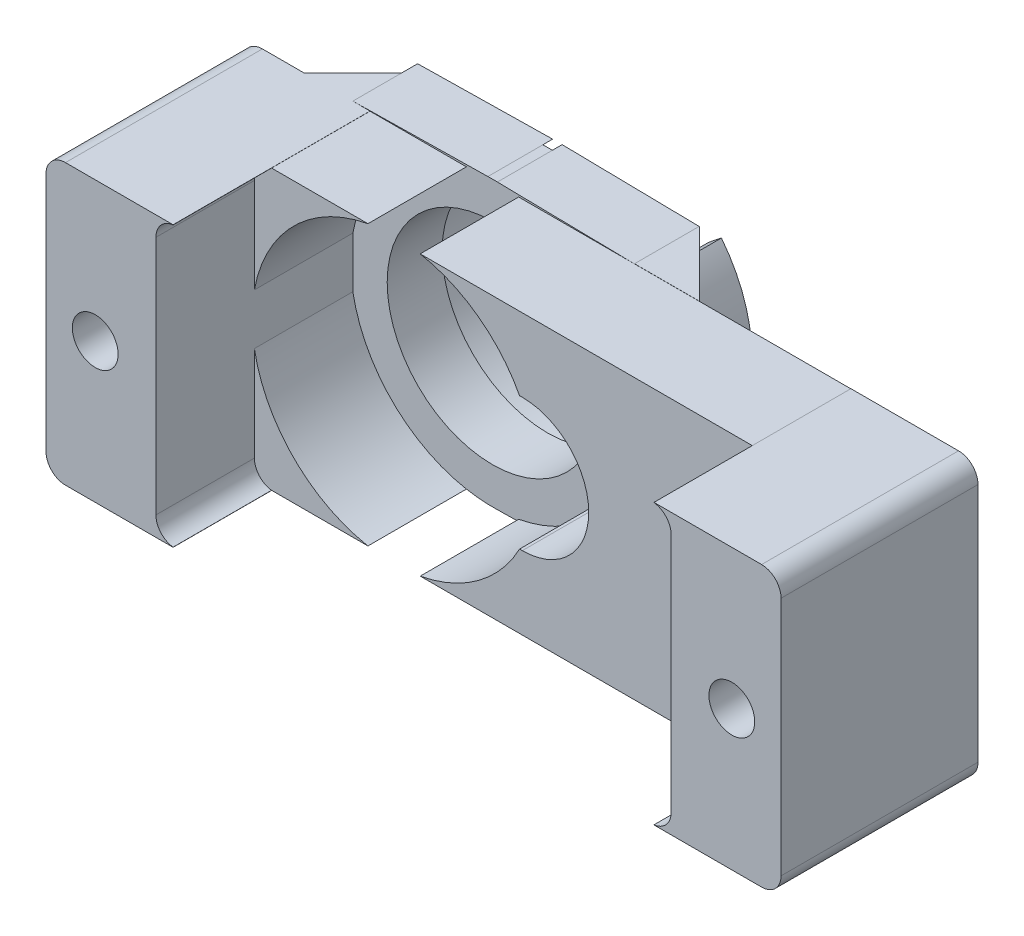
from build123d import *
from build123d.topology import SkipClean

# Parameters (mm, degrees)
SKETCH1_W           = 32.1
SKETCH1_H           = 12.2
BOSS_EXTRUDE1_DEPTH = 4.3
FILLET1_R           = 0.85
CUT_EXTRUDE1_DEPTH  = 10
SKETCH3_R           = 1
CUT_EXTRUDE2_DEPTH  = 5
BOSS_EXTRUDE2_DEPTH = 4.3
SKETCH6_R           = 4.6
BOSS_EXTRUDE3_DEPTH = 2.4
CUT_EXTRUDE4_DEPTH  = 2.4
SKETCH7_R           = 5.5
BOSS_EXTRUDE4_DEPTH = 2.729404
CUT_EXTRUDE3_DEPTH  = 2.729404426
BOSS_EXTRUDE5_DEPTH = 12.194097
BOSS_EXTRUDE6_DEPTH = 2.82843


with BuildPart() as part:
    # Sketch1 → Boss-Extrude1 (new body)
    with BuildSketch(Plane.XY):
        Rectangle(SKETCH1_W, SKETCH1_H)
    extrude(amount=BOSS_EXTRUDE1_DEPTH)

    # Fillet1
    fillet1_edges = [part.edges().sort_by_distance(p)[0] for p in [
        (16.05, -6.1, 2.15),
        (-16.05, -6.1, 2.15),
        (-16.05, 6.1, 2.15),
        (16.05, 6.1, 2.15),
    ]]
    fillet(fillet1_edges, radius=FILLET1_R)

    # Sketch2 → Cut-Extrude1 (cut)
    with BuildSketch(Plane(origin=(0, 0, 0), x_dir=(-1, 0, 0), z_dir=(0, 0, -1))):
        with BuildLine():
            ThreePointArc((-10.4, 6), (-10.930330086, 5.780330086), (-11.15, 5.25))
            Line((-11.15, 5.25), (-11.15, -5.25))
            ThreePointArc((-11.15, -5.25), (-10.930330086, -5.780330086), (-10.4, -6))
            Line((-10.4, -6), (-10.4, -6.1))
            Line((-10.4, -6.1), (10.4, -6.1))
            Line((10.4, -6.1), (10.4, -6))
            ThreePointArc((10.4, -6), (10.930330086, -5.780330086), (11.15, -5.25))
            Line((11.15, -5.25), (11.15, 5.25))
            ThreePointArc((11.15, 5.25), (10.930330086, 5.780330086), (10.4, 6))
            Line((10.4, 6), (10.4, 6.1))
            Line((10.4, 6.1), (-10.4, 6.1))
            Line((-10.4, 6.1), (-10.4, 6))
        make_face()
        with BuildLine():
            Line((-11.15, -5.25), (-11.15, 5.25))
            ThreePointArc((-11.15, 5.25), (-10.930330086, 5.780330086), (-10.4, 6))
            Line((-10.4, 6), (-10.4, 6.1))
            Line((-10.4, 6.1), (-10.5, 6.1))
            Line((-10.5, 6.1), (-10.5, 6.094097151))
            ThreePointArc((-10.5, 6.094097151), (-11.035413251, 5.81457949), (-11.25, 5.25))
            Line((-11.25, 5.25), (-11.25, -5.25))
            ThreePointArc((-11.25, -5.25), (-11.035413251, -5.81457949), (-10.5, -6.094097151))
            Line((-10.5, -6.094097151), (-10.5, -6.1))
            Line((-10.5, -6.1), (-10.4, -6.1))
            Line((-10.4, -6.1), (-10.4, -6))
            ThreePointArc((-10.4, -6), (-10.930330086, -5.780330086), (-11.15, -5.25))
        make_face()
        with BuildLine():
            Line((10.5, 6.1), (10.4, 6.1))
            Line((10.4, 6.1), (10.4, 6))
            ThreePointArc((10.4, 6), (10.930330086, 5.780330086), (11.15, 5.25))
            Line((11.15, 5.25), (11.15, -5.25))
            ThreePointArc((11.15, -5.25), (10.930330086, -5.780330086), (10.4, -6))
            Line((10.4, -6), (10.4, -6.1))
            Line((10.4, -6.1), (10.5, -6.1))
            Line((10.5, -6.1), (10.5, -6.094097151))
            ThreePointArc((10.5, -6.094097151), (11.035413251, -5.81457949), (11.25, -5.25))
            Line((11.25, -5.25), (11.25, 5.25))
            ThreePointArc((11.25, 5.25), (11.035413251, 5.81457949), (10.5, 6.094097151))
            Line((10.5, 6.094097151), (10.5, 6.1))
        make_face()
    extrude(amount=-CUT_EXTRUDE1_DEPTH, mode=Mode.SUBTRACT)


with BuildPart() as cut_extrude1_piece_1:
    # of the separate pieces the step leaves, piece 1, a body of its own (cut_extrude1_pieces)
    add(part.part.solids().sort_by_distance((-15.2, -6.1, 0))[0])


with BuildPart() as cut_extrude1_piece_2:
    # of the separate pieces the step leaves, piece 2, a body of its own (cut_extrude1_pieces)
    add(part.part.solids().sort_by_distance((10.5, -6.1, 0))[0])


with BuildPart() as cut_extrude2_tool:
    # Sketch3 → Cut-Extrude2 (new body)
    with BuildSketch(Plane.XY.offset(4.3)):
        with Locations((-13.9, 0)):
            Circle(SKETCH3_R)
        with Locations((13.9, 0)):
            Circle(SKETCH3_R)
    extrude(amount=-CUT_EXTRUDE2_DEPTH)


with BuildPart() as cut_extrude1_piece_1_1:
    add(cut_extrude1_piece_1.part)

    # Cut-Extrude2: cut by cut_extrude2_tool
    add(cut_extrude2_tool.part, mode=Mode.SUBTRACT)



with BuildPart() as cut_extrude1_piece_2_1:
    add(cut_extrude1_piece_2.part)

    # Cut-Extrude2: cut by cut_extrude2_tool
    add(cut_extrude2_tool.part, mode=Mode.SUBTRACT)


with BuildPart() as cut_extrude1_piece_1_2:
    add(cut_extrude1_piece_1_1.part)

    add(cut_extrude1_piece_2_1.part)  # Boss-Extrude2 merges Cut-Extrude1 piece 2
    # Sketch5 → Boss-Extrude2 (add)
    with BuildSketch(Plane(origin=(0, 0, 0), x_dir=(-1, 0, 0), z_dir=(0, 0, -1))):
        with BuildLine():
            Line((10.5, 6.1), (10.5, 6.094097151))
            Line((10.5, 6.094097151), (6.291043346, 6.094097151))
            ThreePointArc((6.291043346, 6.094097151), (9.545547959, 4.372545957), (11.25, 1.109053651))
            Line((11.25, 1.109053651), (11.25, -1.109053651))
            ThreePointArc((11.25, -1.109053651), (9.545547959, -4.372545957), (6.291043346, -6.094097151))
            Line((6.291043346, -6.094097151), (10.5, -6.094097151))
            Line((10.5, -6.094097151), (10.5, -6.1))
            Line((10.5, -6.1), (15.2, -6.1))
            ThreePointArc((15.2, -6.1), (15.801040764, -5.851040764), (16.05, -5.25))
            Line((16.05, -5.25), (16.05, 5.25))
            ThreePointArc((16.05, 5.25), (15.801040764, 5.851040764), (15.2, 6.1))
            Line((15.2, 6.1), (10.5, 6.1))
        make_face()
        with BuildLine():
            ThreePointArc((-0.329963504, 2.9), (1.474405208, 4.992995386), (4.008956654, 6.094097151))
            Line((4.008956654, 6.094097151), (-10.5, 6.094097151))
            Line((-10.5, 6.094097151), (-10.5, 6.1))
            Line((-10.5, 6.1), (-15.2, 6.1))
            ThreePointArc((-15.2, 6.1), (-15.801040764, 5.851040764), (-16.05, 5.25))
            Line((-16.05, 5.25), (-16.05, -5.25))
            ThreePointArc((-16.05, -5.25), (-15.801040764, -5.851040764), (-15.2, -6.1))
            Line((-15.2, -6.1), (-10.5, -6.1))
            Line((-10.5, -6.1), (-10.5, -6.094097151))
            Line((-10.5, -6.094097151), (4.008956654, -6.094097151))
            ThreePointArc((4.008956654, -6.094097151), (1.474405208, -4.992995386), (-0.329963504, -2.9))
            Line((-0.329963504, -2.9), (-0.45, -2.9))
            ThreePointArc((-0.45, -2.9), (-3.35, 0), (-0.45, 2.9))
            Line((-0.45, 2.9), (-0.329963504, 2.9))
        make_face()
    extrude(amount=BOSS_EXTRUDE2_DEPTH)

    # Sketch12 → Boss-Extrude5 (add)
    with BuildSketch(Plane.XZ.offset(6.094097151)):
        Polygon((1.05, -7.128427125), (3.878427125, -4.3), (1.05, -4.3), align=None)
        Polygon((-11.25, -6.421320344), (-13.371320344, -4.3), (-11.25, -4.3), align=None)
    extrude(amount=-BOSS_EXTRUDE5_DEPTH)



with BuildPart() as body_2:
    # Sketch6 → Boss-Extrude3 (new body)
    with BuildSketch(Plane(origin=(0, 0, -4.3), x_dir=(-1, 0, 0), z_dir=(0, 0, -1))):
        with BuildLine():
            Line((-0.329963504, -2.9), (-0.45, -2.9))
            ThreePointArc((-0.45, -2.9), (-3.35, 0), (-0.45, 2.9))
            Line((-0.45, 2.9), (-0.329963504, 2.9))
            ThreePointArc((-0.329963504, 2.9), (2.45609555, 5.584163215), (6.291043346, 6.094097151))
            ThreePointArc((6.291043346, 6.094097151), (9.545547959, 4.372545957), (11.25, 1.109053651))
            Line((11.25, 1.109053651), (11.25, -1.109053651))
            ThreePointArc((11.25, -1.109053651), (9.545547959, -4.372545957), (6.291043346, -6.094097151))
            ThreePointArc((6.291043346, -6.094097151), (2.45609555, -5.584163215), (-0.329963504, -2.9))
        make_face()
        with Locations((5.15, 0)):
            Circle(SKETCH6_R, mode=Mode.SUBTRACT)
    extrude(amount=BOSS_EXTRUDE3_DEPTH)

    # Sketch11 → Cut-Extrude4 (cut)
    with BuildSketch(Plane(origin=(0, 0, -6.7), x_dir=(-1, 0, 0), z_dir=(0, 0, -1))):
        with BuildLine():
            ThreePointArc((-0.329963504, -2.9), (-1.05, 0), (-0.329963504, 2.9))
            Line((-0.329963504, 2.9), (-0.45, 2.9))
            ThreePointArc((-0.45, 2.9), (-3.35, 0), (-0.45, -2.9))
            Line((-0.45, -2.9), (-0.329963504, -2.9))
        make_face()
        with BuildLine():
            ThreePointArc((-0.329963504, 2.9), (-0.172147578, 3.180368714), (0, 3.452173229))
            Line((0, 3.452173229), (-4.085462696, 3.186724013))
            Line((-4.085462696, 3.186724013), (-4.085462696, -3.40285267))
            Line((-4.085462696, -3.40285267), (0, -3.452173229))
            ThreePointArc((0, -3.452173229), (-0.172147578, -3.180368714), (-0.329963504, -2.9))
            Line((-0.329963504, -2.9), (-0.45, -2.9))
            ThreePointArc((-0.45, -2.9), (-3.35, 0), (-0.45, 2.9))
            Line((-0.45, 2.9), (-0.329963504, 2.9))
        make_face()
    extrude(amount=-CUT_EXTRUDE4_DEPTH, mode=Mode.SUBTRACT)

    # Sketch7 → Boss-Extrude4 (add)
    with SkipClean():  # the faces are left unmerged after this step: merging them gives an invalid solid
        with BuildSketch(Plane(origin=(0, 0, -6.7), x_dir=(-1, 0, 0), z_dir=(0, 0, -1))):
            with BuildLine():
                Line((11.25, -1.109053651), (11.25, 1.109053651))
                ThreePointArc((11.25, 1.109053651), (6.097619924, 6.127154028), (-0.329963504, 2.9))
                ThreePointArc((-0.329963504, 2.9), (-1.05, 0), (-0.329963504, -2.9))
                ThreePointArc((-0.329963504, -2.9), (6.097619924, -6.127154028), (11.25, -1.109053651))
            make_face()
            with Locations((5.15, 0)):
                Circle(SKETCH7_R, mode=Mode.SUBTRACT)
        extrude(amount=BOSS_EXTRUDE4_DEPTH)

    # Sketch8 → Cut-Extrude3 (cut)
    with SkipClean():  # the faces are left unmerged after this step: merging them gives an invalid solid
        with BuildSketch(Plane(origin=(0, 0, -9.429404426), x_dir=(-1, 0, 0), z_dir=(0, 0, -1))):
            Polygon((9.467113453, 3.407716454), (10.016564256, 3.841425821), (10.016564256, 6.311111289), (0.283435744, 6.311111289), (0.283435744, 3.841425821), (0.832886547, 3.407716454), align=None)
        extrude(amount=-CUT_EXTRUDE3_DEPTH, mode=Mode.SUBTRACT)


with BuildPart() as cut_extrude1_piece_1_3:
    with SkipClean():  # the faces are left unmerged after this step: merging them gives an invalid solid
        add(cut_extrude1_piece_1_2.part)

        add(body_2.part)  # Boss-Extrude6 merges body 2
        # Sketch13 → Boss-Extrude6 (add)
        with BuildSketch(Plane(origin=(0, 0, -4.3), x_dir=(-1, 0, 0), z_dir=(0, 0, -1))):
            with BuildLine():
                Line((4.938256081, 6.19638318), (-1.05, 6.094097151))
                Line((-1.05, 6.094097151), (-1.05, 0))
                ThreePointArc((-1.05, 0), (0.691703672, 4.308548926), (4.938256081, 6.19638318))
            make_face()
            with BuildLine():
                Line((11.25, 6.1), (5.353224073, 6.196668458))
                ThreePointArc((5.353224073, 6.196668458), (9.200137595, 4.694292861), (11.25, 1.109053651))
                Line((11.25, 1.109053651), (11.25, 6.1))
            make_face()
            with BuildLine():
                Line((11.25, -6.094097151), (11.25, -1.109053651))
                ThreePointArc((11.25, -1.109053651), (9.545547959, -4.372545957), (6.291043346, -6.094097151))
                Line((6.291043346, -6.094097151), (10.5, -6.094097151))
                Line((10.5, -6.094097151), (10.5, -6.1))
                Line((10.5, -6.1), (10.909996116, -6.1))
                Line((10.909996116, -6.1), (11.25, -6.094097151))
            make_face()
            with BuildLine():
                ThreePointArc((4.938256081, -6.19638318), (0.691703672, -4.308548926), (-1.05, 0))
                Line((-1.05, 0), (-1.05, -6.094097151))
                Line((-1.05, -6.094097151), (4.938256081, -6.19638318))
            make_face()
        extrude(amount=BOSS_EXTRUDE6_DEPTH)


solid = cut_extrude1_piece_1_3.part
